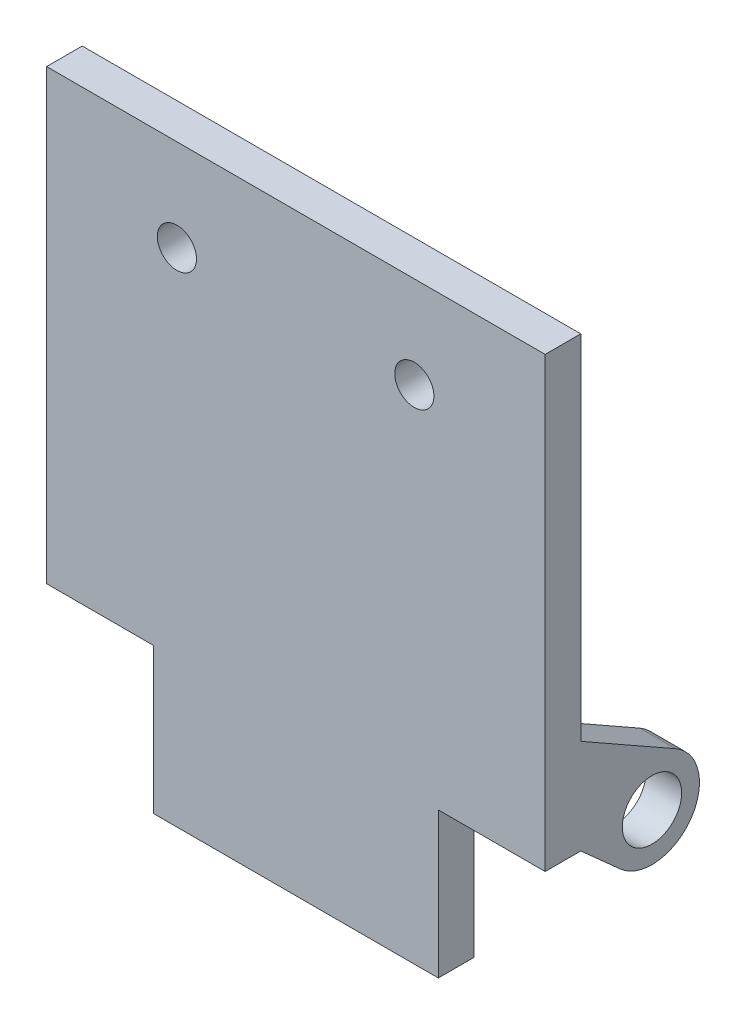
from build123d import *

# Parameters (mm, degrees)
SKETCH_1_W          = 42
SKETCH_1_H          = 50
EXTRUDE_1_DEPTH     = 3
SKETCH_3_W          = 3
SKETCH_3_H          = 5
SKETCH_3_H_2        = 10
EXTRUDE_2_DEPTH     = 12
FILLET_1_R          = 5
FILLET_2_R          = 5
SKETCH_4_R          = 1
CUT_EXTRUDE_1_DEPTH = 39.013155617
SKETCH_5_R          = 2.5
EXTRUDE_3_DEPTH     = 3
SKETCH_6_W          = 9
SKETCH_6_H          = 12.266046359
CUT_EXTRUDE_2_DEPTH = 35.785054334
SKETCH_7_R          = 1.65
CUT_EXTRUDE_3_DEPTH = 36.930488516
FILLET_3_R          = 3


with BuildPart() as part:
    # 草图1 → 凸台-拉伸1 (new body)
    with BuildSketch(Plane.XY):
        Rectangle(SKETCH_1_W, SKETCH_1_H)
    extrude(amount=EXTRUDE_1_DEPTH)

    # 草图3 → 凸台-拉伸2 (add)
    with BuildSketch(Plane(origin=(0, 0, 0), x_dir=(-1, 0, 0), z_dir=(0, 0, -1))):
        with Locations((3.5, -22.5)):
            Rectangle(SKETCH_3_W, SKETCH_3_H)
        with Locations((3.5, 8)):
            Rectangle(SKETCH_3_W, SKETCH_3_H_2)
    extrude(amount=EXTRUDE_2_DEPTH)

    # 圆角1
    fillet_1_edges = [part.edges().sort_by_distance(p)[0] for p in [
        (-2, 8, 0),
    ]]
    fillet(fillet_1_edges, radius=FILLET_1_R)

    # 圆角2
    fillet_2_edges = [part.edges().sort_by_distance(p)[0] for p in [
        (-2, -22.5, 0),
    ]]
    fillet(fillet_2_edges, radius=FILLET_2_R)

    # 草图4 → 切除-拉伸1 (cut, through all)
    with BuildSketch(Plane.ZY.offset(5)):
        with Locations((-5.946968178, -22)):
            Circle(SKETCH_4_R)
        with Locations((-5.946968178, 5)):
            Circle(SKETCH_4_R)
    extrude(amount=-CUT_EXTRUDE_1_DEPTH, mode=Mode.SUBTRACT)

    # 草图5 → 凸台-拉伸3 (add)
    with BuildSketch(Plane(origin=(21, 0, 0), x_dir=(0, 0, -1), z_dir=(1, 0, 0))):
        with BuildLine():
            Line((0, -4.733953641), (0, -12.733953641))
            Line((0, -12.733953641), (3.333333333, -15.715377611))
            ThreePointArc((3.333333333, -15.715377611), (9.249103106, -15.067047939), (7.972848445, -9.254317307))
            Line((7.972848445, -9.254317307), (0, -4.733953641))
        make_face()
        with Locations(Location((6, -12.733953641, 0), (0, 0, 90))):
            Circle(SKETCH_5_R, mode=Mode.SUBTRACT)
    extrude(amount=-EXTRUDE_3_DEPTH)

    # 草图6 → 切除-拉伸2 (cut, through all)
    with BuildSketch(Plane(origin=(0, 0, 0), x_dir=(-1, 0, 0), z_dir=(0, 0, -1))):
        with Locations((-16.5, -18.86697682)):
            Rectangle(SKETCH_6_W, SKETCH_6_H)
        with Locations((16.5, -18.86697682)):
            Rectangle(SKETCH_6_W, SKETCH_6_H)
    extrude(amount=-CUT_EXTRUDE_2_DEPTH, mode=Mode.SUBTRACT)

    # 草图7 → 切除-拉伸3 (cut, through all)
    with BuildSketch(Plane.XY.offset(3)):
        with Locations((9.975799492, 17.266046359)):
            Circle(SKETCH_7_R)
        with Locations((-10.024200508, 17.266046359)):
            Circle(SKETCH_7_R)
    extrude(amount=-CUT_EXTRUDE_3_DEPTH, mode=Mode.SUBTRACT)

    # 圆角3
    fillet_3_edges = [part.edges().sort_by_distance(p)[0] for p in [
        (-3.5, -25, -12),
    ]]
    fillet(fillet_3_edges, radius=FILLET_3_R)


solid = part.part
